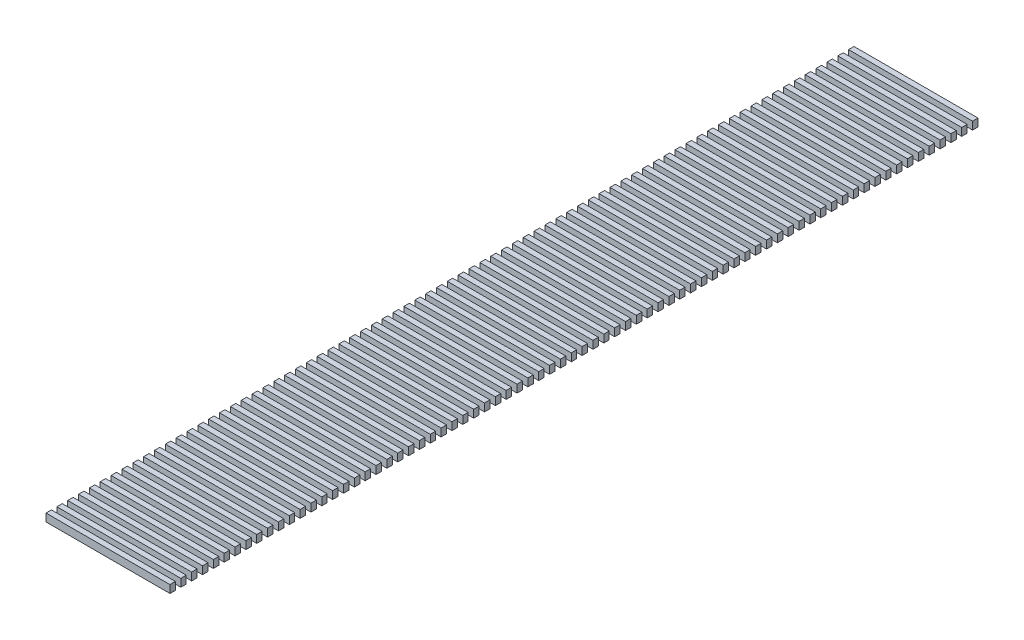
from build123d import *

# Parameters (mm, degrees)
SKETCH1_W           = 160
SKETCH1_H           = 1050
BOSS_EXTRUDE1_DEPTH = 10
CUT_EXTRUDE1_REACH  = 533.154
SKETCH2_W           = 160
SKETCH2_H           = 7
LPATTERN1_COUNT     = 75
LPATTERN1_PITCH     = 14


with BuildPart() as part:
    # Sketch1 → Boss-Extrude1 (new body)
    with BuildSketch(Plane(origin=(0, 0, 0), x_dir=(1, 0, 0), z_dir=(0, 1, 0))):
        Rectangle(SKETCH1_W, SKETCH1_H)
    extrude(amount=-BOSS_EXTRUDE1_DEPTH)

    # Sketch2 → Cut-Extrude1 (cut, up to next)
    with BuildSketch(Plane(origin=(0, -10, 0), x_dir=(-1, 0, 0), z_dir=(0, -1, 0)), mode=Mode.PRIVATE) as cut_extrude1_sk1:
        with Locations((0, 514.5)):
            Rectangle(SKETCH2_W, SKETCH2_H)
    cut_extrude1_tool1 = extrude(cut_extrude1_sk1.sketch, amount=-CUT_EXTRUDE1_REACH, mode=Mode.PRIVATE) & part.part
    cut_extrude1 = cut_extrude1_tool1.solids().sort_by_distance((0, -10, -514.5))[0]
    add(cut_extrude1, mode=Mode.SUBTRACT)


with BuildPart() as cut_extrude1_piece_1:
    # of the separate pieces the step leaves, piece 1, a body of its own (cut_extrude1_pieces)
    add(part.part.solids().sort_by_distance((-80, 0, 525))[0])

    # LPattern1: Cut-Extrude1 ×75
    with Locations(*[(0, 0, i * LPATTERN1_PITCH) for i in range(1, LPATTERN1_COUNT)]):
        add(cut_extrude1, mode=Mode.SUBTRACT)


with BuildPart() as cut_extrude1_piece_2:
    # of the separate pieces the step leaves, piece 2, a body of its own (cut_extrude1_pieces)
    add(part.part.solids().sort_by_distance((-80, 0, -525))[0])


solid = Compound([cut_extrude1_piece_1.part, cut_extrude1_piece_2.part])
